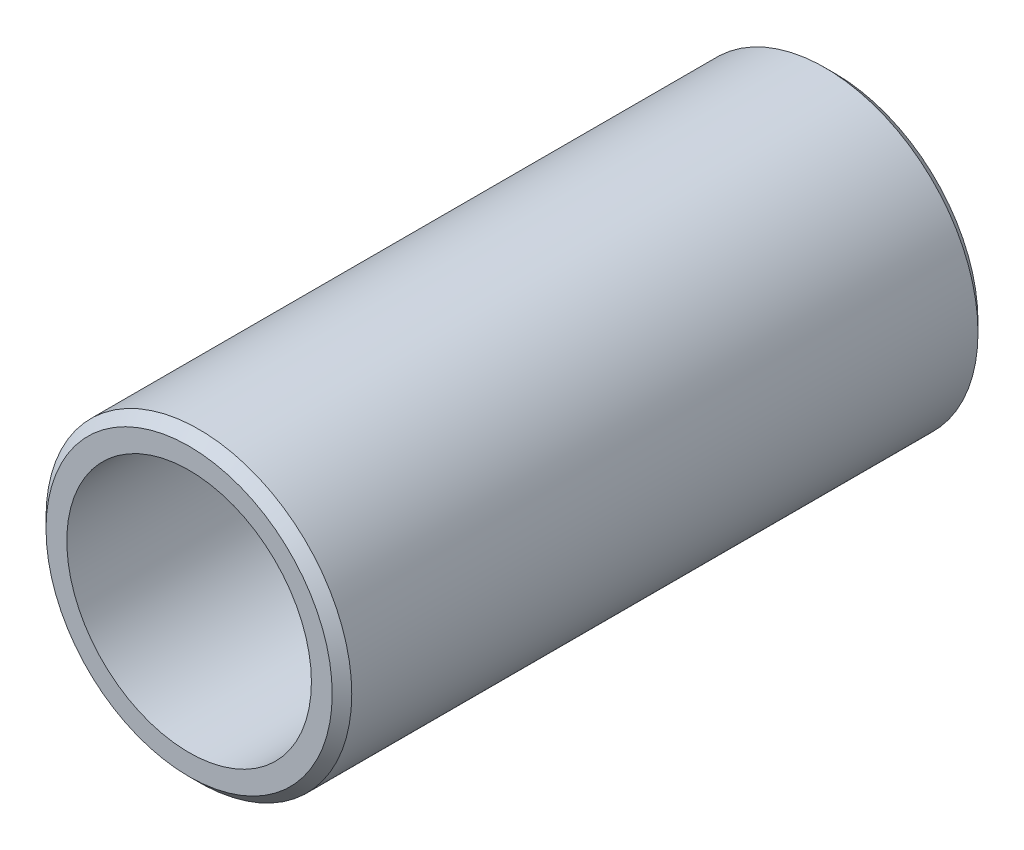
from build123d import *

# Parameters (mm, degrees)
SKETCH1_R           = 7.9375
SKETCH1_R_2         = 6.35
BOSS_EXTRUDE1_DEPTH = 33.528
CHAMFER1_SIZE       = 0.508


with BuildPart() as part:
    # Sketch1 → Boss-Extrude1 (new body)
    with BuildSketch(Plane.XY):
        Circle(SKETCH1_R)
        Circle(SKETCH1_R_2, mode=Mode.SUBTRACT)
    extrude(amount=BOSS_EXTRUDE1_DEPTH)

    # Chamfer1
    chamfer1_edges = [part.edges().sort_by_distance(p)[0] for p in [
        (-7.9375, 0, 0),
        (-7.9375, 0, 33.528),
    ]]
    chamfer(chamfer1_edges, length=CHAMFER1_SIZE)


solid = part.part
